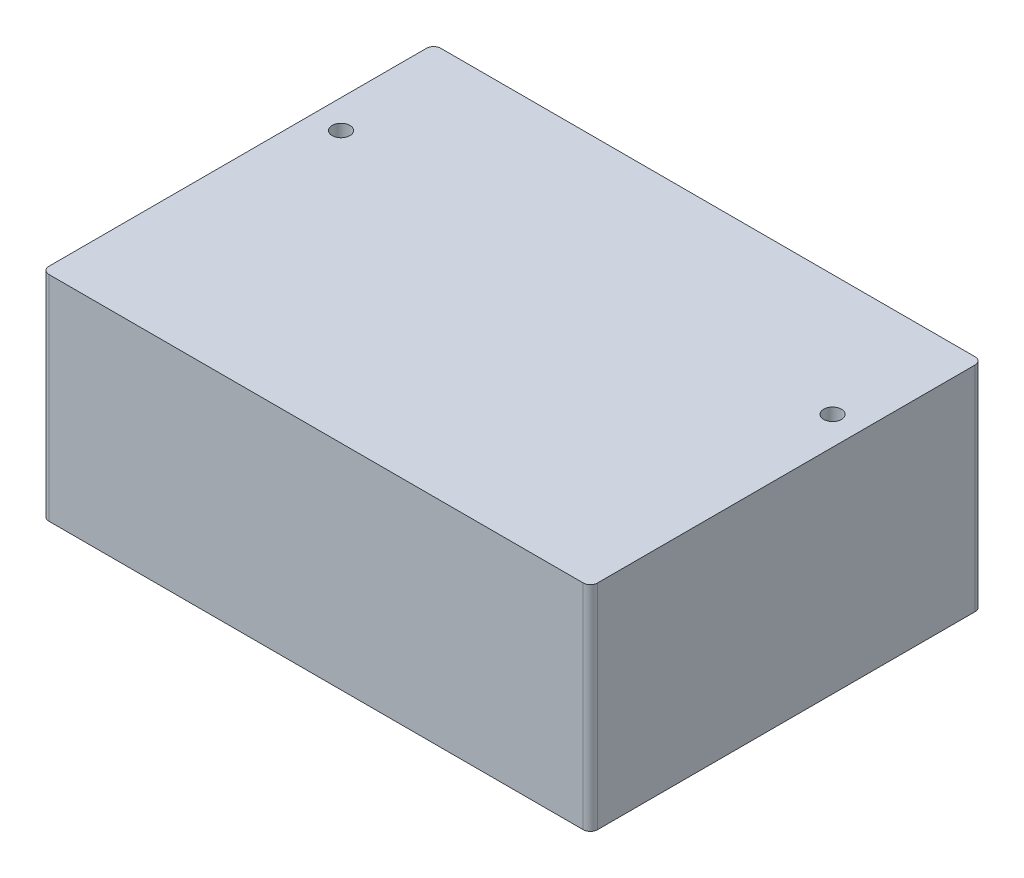
from build123d import *

# Parameters (mm, degrees)
SKETCH1_W           = 77
SKETCH1_H           = 60
BOSS_EXTRUDE1_DEPTH = 30
FILLET1_R           = 1
SKETCH2_W           = 77
SKETCH2_H           = 5.029469172
CUT_EXTRUDE1_DEPTH  = 40
FILLET3_R           = 1
SKETCH5_R           = 1.25
CUT_EXTRUDE4_DEPTH  = 5
SKETCH6_R           = 1.25
CUT_EXTRUDE5_DEPTH  = 5
SKETCH7_R           = 1.25
CUT_EXTRUDE6_DEPTH  = 5


with BuildPart() as part:
    # Sketch1 → Boss-Extrude1 (new body)
    with BuildSketch(Plane(origin=(0, 0, 0), x_dir=(1, 0, 0), z_dir=(0, 1, 0))):
        with Locations((38.5, 30)):
            Rectangle(SKETCH1_W, SKETCH1_H)
    extrude(amount=BOSS_EXTRUDE1_DEPTH)

    # Fillet1
    fillet1_edges = [part.edges().sort_by_distance(p)[0] for p in [
        (0, 15, -60),
        (77, 15, -60),
        (77, 15, 0),
        (0, 15, 0),
    ]]
    fillet(fillet1_edges, radius=FILLET1_R)

    # Sketch2 → Cut-Extrude1 (cut)
    with BuildSketch(Plane(origin=(0, 30, 0), x_dir=(1, 0, 0), z_dir=(0, 1, 0))):
        with Locations((38.5, 57.514734586)):
            Rectangle(SKETCH2_W, SKETCH2_H)
    extrude(amount=-CUT_EXTRUDE1_DEPTH, mode=Mode.SUBTRACT)

    # Fillet3
    fillet3_edges = [part.edges().sort_by_distance(p)[0] for p in [
        (0, 15, -55),
        (77, 15, -55),
    ]]
    fillet(fillet3_edges, radius=FILLET3_R)

    # Sketch5 → Cut-Extrude4 (cut)
    with BuildSketch(Plane.XZ):
        with Locations(Location((73, -17.515605611, 0), (0, 0, 270))):
            Circle(SKETCH5_R)
    extrude(amount=-CUT_EXTRUDE4_DEPTH, mode=Mode.SUBTRACT)

    # Sketch6 → Cut-Extrude5 (cut)
    with BuildSketch(Plane.XZ):
        with Locations(Location((4, -17.515605611, 0), (0, 0, 270))):
            Circle(SKETCH6_R)
    extrude(amount=-CUT_EXTRUDE5_DEPTH, mode=Mode.SUBTRACT)

    # Sketch7 → Cut-Extrude6 (cut)
    with BuildSketch(Plane(origin=(0, 30, 0), x_dir=(1, 0, 0), z_dir=(0, 1, 0))):
        with Locations(Location((73, 38, 0), (0, 0, 270))):
            Circle(SKETCH7_R)
        with Locations(Location((4, 38, 0), (0, 0, 270))):
            Circle(SKETCH7_R)
    extrude(amount=-CUT_EXTRUDE6_DEPTH, mode=Mode.SUBTRACT)


solid = part.part
